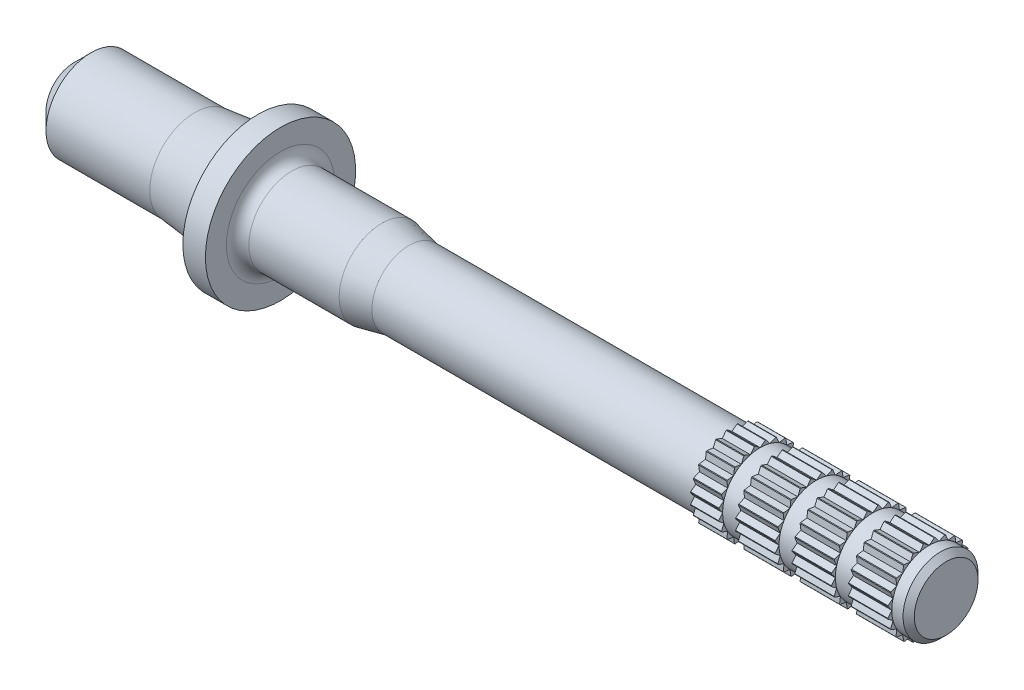
from build123d import *

# Parameters (mm, degrees)
CUT_EXTRUDE1_REACH = 40.956
CIRPATTERN1_COUNT  = 24
SKETCH3_OUTSIDE_W  = 16.622
SKETCH3_OUTSIDE_H  = 16.622
SKETCH3_OUTSIDE_R  = 1.663661537
CUT_EXTRUDE2_DEPTH = 0.75
LPATTERN1_COUNT    = 4
LPATTERN1_PITCH    = 2.5
CHAMFER1_SIZE      = 0.75
CHAMFER2_SIZE      = 0.25
FILLET1_R          = 0.5


with BuildPart() as part:
    # Sketch1 → Revolve1 (revolve)
    with BuildSketch(Plane.XY, mode=Mode.PRIVATE) as revolve1_sk:
        Polygon((0, 0), (0, 2), (5.35, 2), (8.15, 2.331401839), (8.15, 3.331401839), (9.15, 3.331401839), (9.15, 1.901401839), (13.65, 1.901401839), (14.85, 1.646333965), (29.17, 1.646333965), (29.17, 1.85), (38.67, 1.85), (38.67, 0), align=None)
    revolve(revolve1_sk.sketch.rotate(Axis((0, 0, 0), (1, 0, 0)), 90), axis=Axis((0, 0, 0), (1, 0, 0)))

    # Sketch2 → Cut-Extrude1 (cut, up to next)
    with BuildSketch(Plane(origin=(38.67, 0, 0), x_dir=(0, 0, -1), z_dir=(1, 0, 0)), mode=Mode.PRIVATE) as cut_extrude1_sk1:
        with BuildLine():
            Line((-0.224951096, 1.836272584), (0, 1.663661537))
            Line((0, 1.663661537), (0.224951096, 1.836272584))
            ThreePointArc((0.224951096, 1.836272584), (0, 1.85), (-0.224951096, 1.836272584))
        make_face()
    cut_extrude1_tool1 = extrude(cut_extrude1_sk1.sketch, amount=-CUT_EXTRUDE1_REACH, mode=Mode.PRIVATE) & part.part
    cut_extrude1 = cut_extrude1_tool1.solids().sort_by_distance((38.67, 1.784782, 0))[0]
    add(cut_extrude1, mode=Mode.SUBTRACT)

    # CirPattern1: Cut-Extrude1 ×24 about axis
    cirpattern1_axis = Axis((0, 0, 0), (1, 0, 0))
    for i in range(1, CIRPATTERN1_COUNT):
        add(cut_extrude1.rotate(cirpattern1_axis, i * 360 / CIRPATTERN1_COUNT), mode=Mode.SUBTRACT)

    # Sketch3 outside → Cut-Extrude2 (cut)
    with BuildSketch(Plane(origin=(38.67, 0, 0), x_dir=(0, 0, -1), z_dir=(1, 0, 0))):
        Rectangle(SKETCH3_OUTSIDE_W, SKETCH3_OUTSIDE_H)
        Circle(SKETCH3_OUTSIDE_R, mode=Mode.SUBTRACT)
    cut_extrude2 = extrude(amount=-CUT_EXTRUDE2_DEPTH, mode=Mode.SUBTRACT)

    # LPattern1: Cut-Extrude2 ×4
    with Locations(*[(-i * LPATTERN1_PITCH, 0, 0) for i in range(1, LPATTERN1_COUNT)]):
        add(cut_extrude2, mode=Mode.SUBTRACT)

    # Chamfer1
    chamfer1_edges = [part.edges().sort_by_distance(p)[0] for p in [
        (0, 0, -2),
    ]]
    chamfer(chamfer1_edges, length=CHAMFER1_SIZE)

    # Chamfer2
    chamfer2_edges = [part.edges().sort_by_distance(p)[0] for p in [
        (38.67, 0, 1.663661537),
    ]]
    chamfer(chamfer2_edges, length=CHAMFER2_SIZE)

    # Fillet1
    fillet1_edges = [part.edges().sort_by_distance(p)[0] for p in [
        (9.15, 0, -1.901401839),
        (8.15, 0, -2.331401839),
    ]]
    fillet(fillet1_edges, radius=FILLET1_R)


solid = part.part
